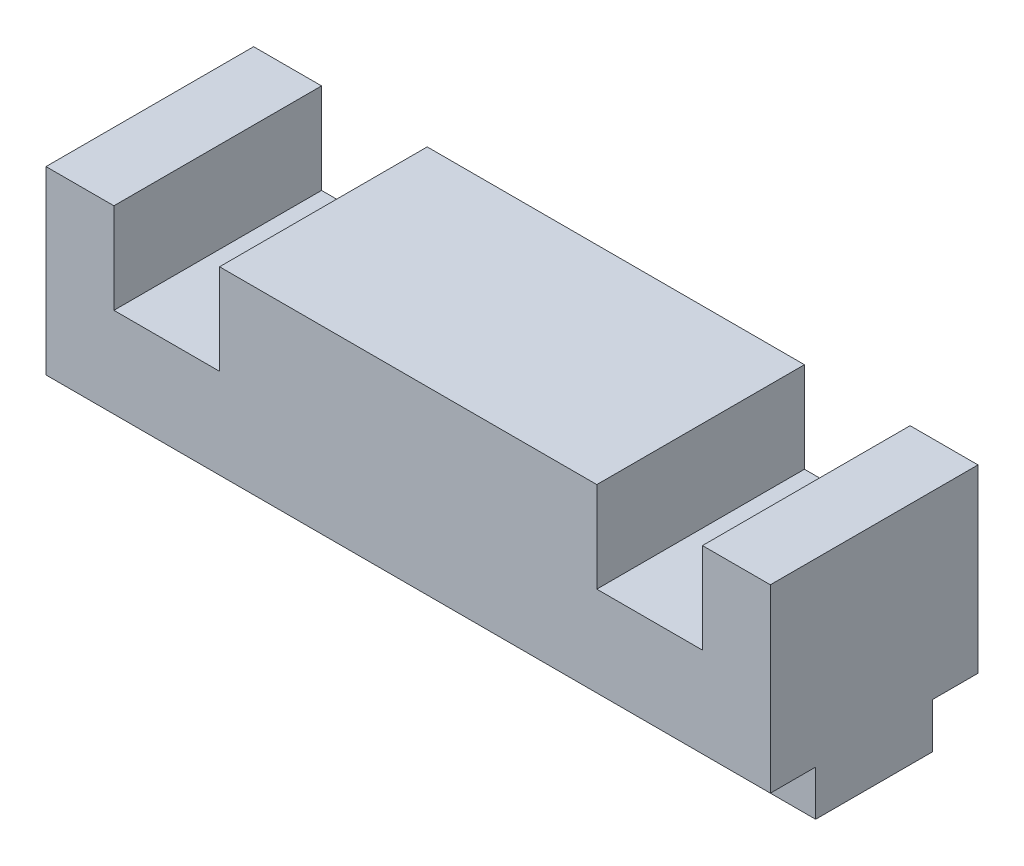
from build123d import *

# Parameters (mm, degrees)
SKETCH1_W                            = 76.2
SKETCH1_H                            = 21.844
STOCK_DEPTH                          = 23.749
CLEARANCE_HOLES_FOR_MOUNTING_BOLTS_D = 6.7564
SKETCH5_W                            = 76.2
SKETCH5_H                            = 4.7625
CLEARANCE_RABBIT_DEPTH               = 4.7625
SKETCH6_W                            = 11.1125
SKETCH6_H                            = 9.525
CUT_EXTRUDE1_DEPTH                   = 50.927801243


with BuildPart() as part:
    # Sketch1 → Stock (new body)
    with BuildSketch(Plane(origin=(0, 0, 0), x_dir=(1, 0, 0), z_dir=(0, 1, 0))):
        Rectangle(SKETCH1_W, SKETCH1_H)
    extrude(amount=STOCK_DEPTH)

    # Clearance holes for Mounting Bolts (through all)
    with Locations(Plane(origin=(0, 23.749, 0), x_dir=(1, 0, 0), z_dir=(0, 1, 0))):
        with Locations((-25.4, 0), (25.4, 0)):
            Hole(CLEARANCE_HOLES_FOR_MOUNTING_BOLTS_D / 2)

    # Sketch5 → Clearance Rabbit (cut)
    with BuildSketch(Plane.XZ):
        with Locations((0, 8.54075)):
            Rectangle(SKETCH5_W, SKETCH5_H)
        with Locations((0, -8.54075)):
            Rectangle(SKETCH5_W, SKETCH5_H)
    extrude(amount=-CLEARANCE_RABBIT_DEPTH, mode=Mode.SUBTRACT)

    # Sketch6 → Cut-Extrude1 (cut, through all)
    with BuildSketch(Plane.XY.offset(10.922)):
        with Locations((-25.4, 18.9865)):
            Rectangle(SKETCH6_W, SKETCH6_H)
        with Locations((25.4, 18.9865)):
            Rectangle(SKETCH6_W, SKETCH6_H)
    extrude(amount=-CUT_EXTRUDE1_DEPTH, mode=Mode.SUBTRACT)


solid = part.part
